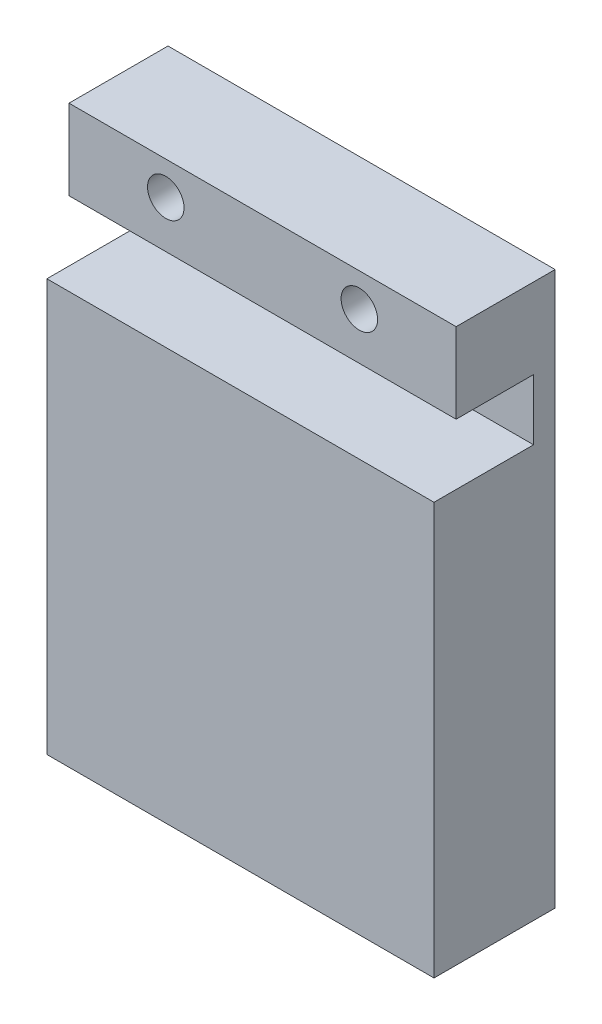
from build123d import *

# Parameters (mm, degrees)
SKIZZE1_W                       = 35
SKIZZE1_H                       = 50
SKIZZE1_R                       = 1.65
AUFSATZ_LINEAR_AUSTRAGEN1_DEPTH = 10.95
SKIZZE2_W                       = 50
SKIZZE2_H                       = 5.5
SCHNITT_LINEAR_AUSTRAGEN1_DEPTH = 9
SKIZZE3_W                       = 35
SKIZZE3_H                       = 7.25
SCHNITT_LINEAR_AUSTRAGEN2_DEPTH = 2


with BuildPart() as part:
    # Skizze1 → Aufsatz-Linear austragen1 (new body)
    with BuildSketch(Plane.XY):
        Rectangle(SKIZZE1_W, SKIZZE1_H)
        with Locations((-8.75, 22)):
            Circle(SKIZZE1_R, mode=Mode.SUBTRACT)
        with Locations((8.75, 22)):
            Circle(SKIZZE1_R, mode=Mode.SUBTRACT)
    extrude(amount=AUFSATZ_LINEAR_AUSTRAGEN1_DEPTH)

    # Skizze2 → Schnitt-Linear austragen1 (cut)
    with BuildSketch(Plane.XY.offset(10.95)):
        with Locations((0, 15)):
            Rectangle(SKIZZE2_W, SKIZZE2_H)
    extrude(amount=-SCHNITT_LINEAR_AUSTRAGEN1_DEPTH, mode=Mode.SUBTRACT)

    # Skizze3 → Schnitt-Linear austragen2 (cut)
    with BuildSketch(Plane.XY.offset(10.95)):
        with Locations((0, 21.375)):
            Rectangle(SKIZZE3_W, SKIZZE3_H)
    extrude(amount=-SCHNITT_LINEAR_AUSTRAGEN2_DEPTH, mode=Mode.SUBTRACT)


solid = part.part
